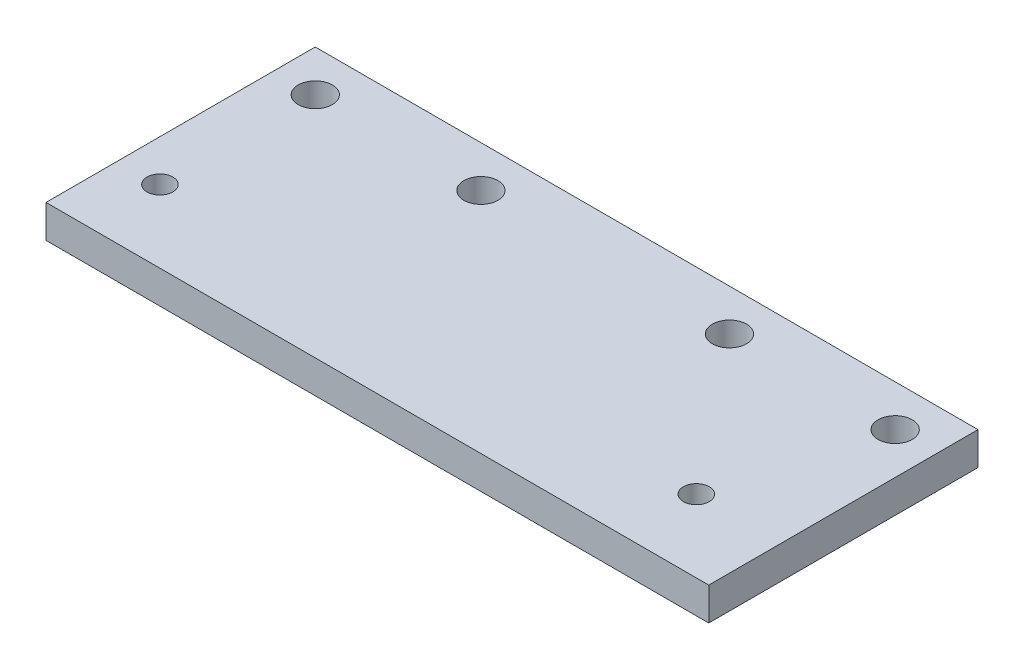
from build123d import *

# Parameters (mm, degrees)
SKETCH1_W           = 64
SKETCH1_H           = 26
SKETCH1_R           = 1.65
SKETCH1_R_2         = 1.25
BOSS_EXTRUDE1_DEPTH = 3.175


with BuildPart() as part:
    # Sketch1 → Boss-Extrude1 (new body)
    with BuildSketch(Plane(origin=(0, 0, 0), x_dir=(1, 0, 0), z_dir=(0, 1, 0))):
        with Locations((32, 13)):
            Rectangle(SKETCH1_W, SKETCH1_H)
        with Locations(Location((4, 22, 0), (0, 0, 270))):
            Circle(SKETCH1_R, mode=Mode.SUBTRACT)
        with Locations(Location((20, 22, 0), (0, 0, 270))):
            Circle(SKETCH1_R, mode=Mode.SUBTRACT)
        with Locations(Location((60, 22, 0), (0, 0, 270))):
            Circle(SKETCH1_R, mode=Mode.SUBTRACT)
        with Locations(Location((44, 22, 0), (0, 0, 270))):
            Circle(SKETCH1_R, mode=Mode.SUBTRACT)
        with Locations(Location((4, 7, 0), (0, 0, 270))):
            Circle(SKETCH1_R_2, mode=Mode.SUBTRACT)
        with Locations(Location((55.8, 7, 0), (0, 0, 270))):
            Circle(SKETCH1_R_2, mode=Mode.SUBTRACT)
    extrude(amount=BOSS_EXTRUDE1_DEPTH)


solid = part.part
